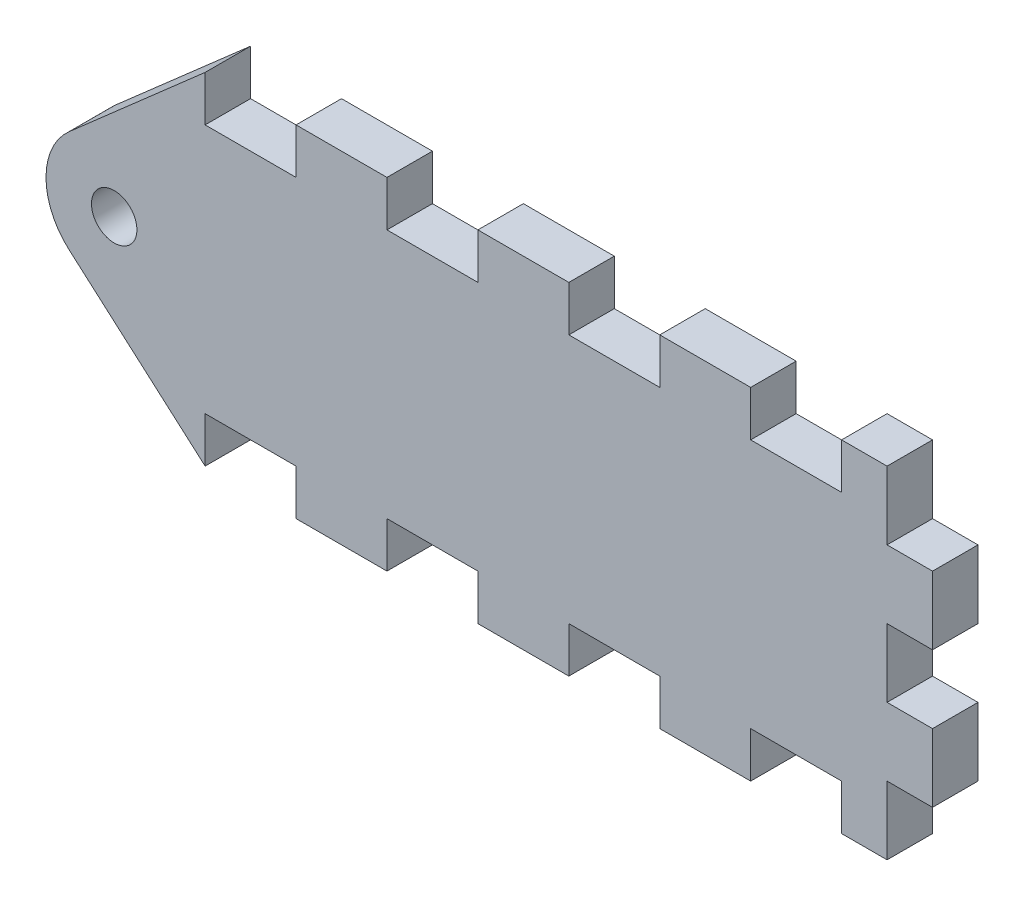
from build123d import *

# Parameters (mm, degrees)
MASS_DEPTH          = 6.35
SKETCH4_R           = 3.175
CUT_EXTRUDE1_DEPTH  = 78.071449197
SKETCH3_W           = 12.7
SKETCH3_H           = 12.7
CUT_EXTRUDE2_DEPTH  = 78.071449197
LPATTERN1_COUNT     = 4
LPATTERN1_PITCH     = 25.4
SKETCH5_W           = 12.7
SKETCH5_H           = 9.525
CUT_EXTRUDE3_DEPTH  = 78.071449197
LPATTERN2_COUNT     = 2
LPATTERN2_PITCH     = 19.05
LPATTERN2_COL_COUNT = 2
LPATTERN2_COL_PITCH = 19.05


with BuildPart() as part:
    # Sketch1 → Mass (new body)
    with BuildSketch(Plane.XY):
        with BuildLine():
            Line((-50.8, -23.8125), (50.8, -23.8125))
            Line((50.8, -23.8125), (50.8, 23.8125))
            Line((50.8, 23.8125), (-50.8, 23.8125))
            Line((-50.8, 23.8125), (-69.781543236, 7.160156393))
            ThreePointArc((-69.781543236, 7.160156393), (-73.025, 0), (-69.781543236, -7.160156393))
            Line((-69.781543236, -7.160156393), (-50.8, -23.8125))
        make_face()
    extrude(amount=MASS_DEPTH)

    # Sketch4 → Cut-Extrude1 (cut, through all)
    with BuildSketch(Plane(origin=(0, 0, 0), x_dir=(-1, 0, 0), z_dir=(0, 0, -1))):
        with Locations((63.5, 0)):
            Circle(SKETCH4_R)
    extrude(amount=-CUT_EXTRUDE1_DEPTH, mode=Mode.SUBTRACT)

    # Sketch3 → Cut-Extrude2 (cut, through all)
    with BuildSketch(Plane(origin=(0, 0, 0), x_dir=(-1, 0, 0), z_dir=(0, 0, -1))):
        with Locations((-31.75, 23.8125)):
            Rectangle(SKETCH3_W, SKETCH3_H)
        with Locations((-31.75, -23.8125)):
            Rectangle(SKETCH3_W, SKETCH3_H)
    cut_extrude2 = extrude(amount=-CUT_EXTRUDE2_DEPTH, mode=Mode.SUBTRACT)

    # LPattern1: Cut-Extrude2 ×4
    with Locations(*[(-i * LPATTERN1_PITCH, 0, 0) for i in range(1, LPATTERN1_COUNT)]):
        add(cut_extrude2, mode=Mode.SUBTRACT)

    # Sketch5 → Cut-Extrude3 (cut, through all)
    with BuildSketch(Plane(origin=(0, 0, 0), x_dir=(-1, 0, 0), z_dir=(0, 0, -1))):
        with Locations((-50.8, 0)):
            Rectangle(SKETCH5_W, SKETCH5_H)
    cut_extrude3 = extrude(amount=-CUT_EXTRUDE3_DEPTH, mode=Mode.SUBTRACT)

    # LPattern2: Cut-Extrude3 ×2
    with Locations(*[(0, -i * LPATTERN2_PITCH, 0) for i in range(1, LPATTERN2_COUNT)]):
        add(cut_extrude3, mode=Mode.SUBTRACT)

    # LPattern2 col: Cut-Extrude3 ×2
    with Locations(*[(0, i * LPATTERN2_COL_PITCH, 0) for i in range(1, LPATTERN2_COL_COUNT)]):
        add(cut_extrude3, mode=Mode.SUBTRACT)


solid = part.part
